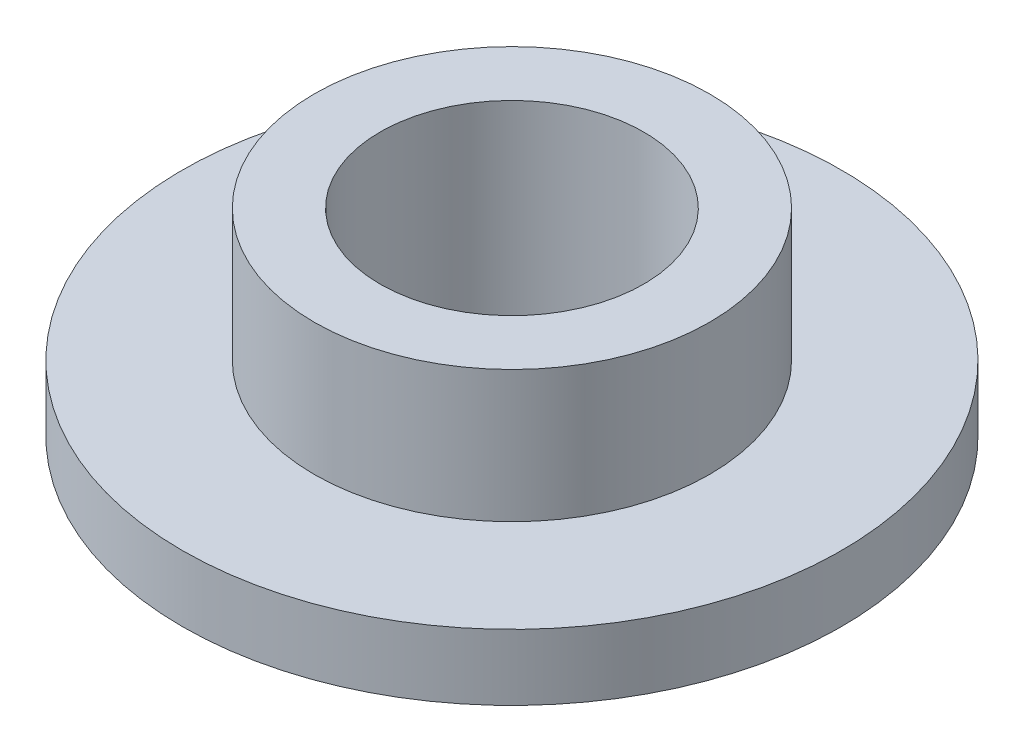
from build123d import *

# Parameters (mm, degrees)
SKETCH1_R           = 5
SKETCH1_R_2         = 2
BOSS_EXTRUDE3_DEPTH = 1
SKETCH3_R           = 3
SKETCH3_R_2         = 2
BOSS_EXTRUDE4_DEPTH = 2


with BuildPart() as part:
    # Sketch1 → Boss-Extrude3 (new body)
    with BuildSketch(Plane(origin=(0, 0, 0), x_dir=(1, 0, 0), z_dir=(0, 1, 0))):
        with Locations(Location((0, 0, 0), (0, 0, 270))):
            Circle(SKETCH1_R)
        with Locations(Location((0, 0, 0), (0, 0, 270))):
            Circle(SKETCH1_R_2, mode=Mode.SUBTRACT)
    extrude(amount=BOSS_EXTRUDE3_DEPTH)

    # Sketch3 → Boss-Extrude4 (add)
    with BuildSketch(Plane(origin=(0, 1, 0), x_dir=(1, 0, 0), z_dir=(0, 1, 0))):
        with Locations(Location((0, 0, 0), (0, 0, 270))):
            Circle(SKETCH3_R)
        with Locations(Location((0, 0, 0), (0, 0, 270))):
            Circle(SKETCH3_R_2, mode=Mode.SUBTRACT)
    extrude(amount=BOSS_EXTRUDE4_DEPTH)


solid = part.part
